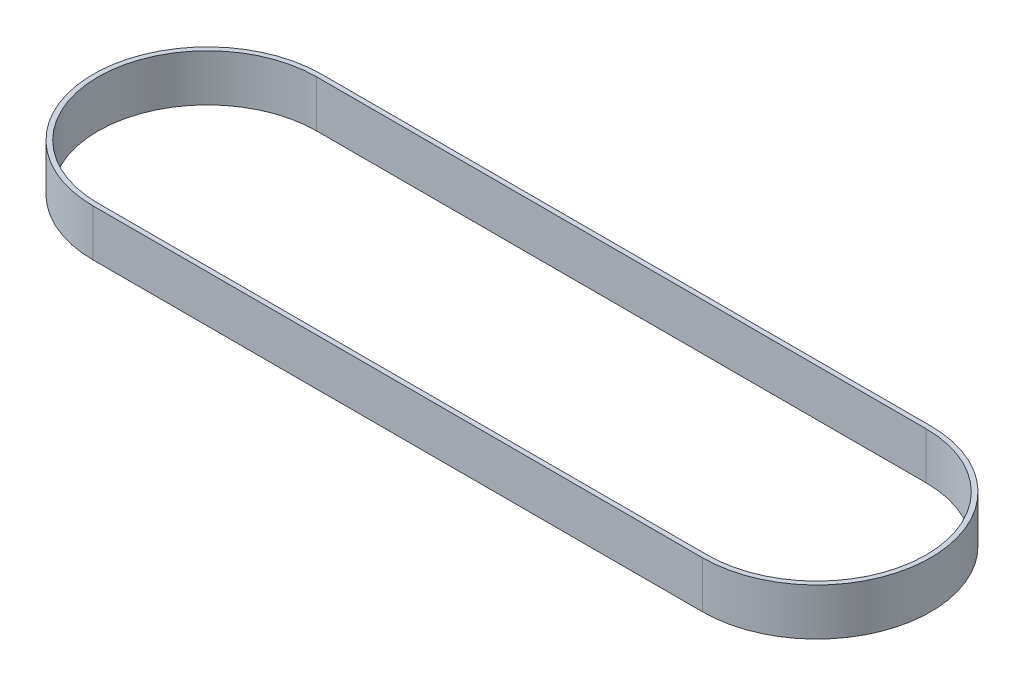
from build123d import *

# Parameters (mm, degrees)
BOSS_EXTRUDE1_DEPTH = 15


with BuildPart() as part:
    # Sketch1 → Boss-Extrude1 (new body)
    with BuildSketch(Plane(origin=(0, 0, 0), x_dir=(1, 0, 0), z_dir=(0, 1, 0))):
        with BuildLine():
            Line((0, -36.5379), (195.0466, -36.5379))
            ThreePointArc((195.0466, -36.5379), (231.5845, 0), (195.0466, 36.5379))
            Line((195.0466, 36.5379), (0, 36.5379))
            ThreePointArc((0, 36.5379), (-36.5379, 0), (0, -36.5379))
        make_face()
        with BuildLine():
            Line((0, 35.0139), (195.0466, 35.0139))
            ThreePointArc((195.0466, 35.0139), (230.0605, 0), (195.0466, -35.0139))
            Line((195.0466, -35.0139), (0, -35.0139))
            ThreePointArc((0, -35.0139), (-35.0139, 0), (0, 35.0139))
        make_face(mode=Mode.SUBTRACT)
    extrude(amount=BOSS_EXTRUDE1_DEPTH)


solid = part.part
